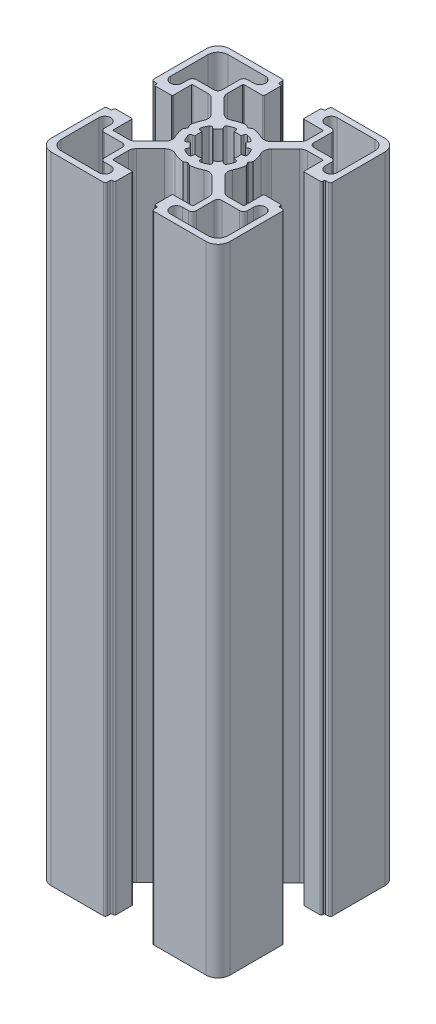
from build123d import *

# Parameters (mm, degrees)
BOSS_EXTRUDE1_DEPTH = 160


with BuildPart() as part:
    # Sketch1 → Boss-Extrude1 (new body)
    with BuildSketch(Plane(origin=(0, 0, 0), x_dir=(1, 0, 0), z_dir=(0, 1, 0))):
        with BuildLine():
            Line((7.563483841, 5.858695924), (11.129779796, 9.424987881))
            ThreePointArc((11.129779796, 9.424987881), (11.76062452, 9.846504465), (12.504756421, 9.994521395))
            Line((12.504756421, 9.994521395), (16.316902359, 9.994521395))
            ThreePointArc((16.316902359, 9.994521395), (16.458323963, 9.935942648), (16.51690271, 9.794521044))
            Line((16.51690271, 9.794521044), (16.51690271, 5.20001408))
            ThreePointArc((16.51690271, 5.20001408), (16.575481456, 5.058592476), (16.716903061, 5.000013729))
            Line((16.716903061, 5.000013729), (20.719599813, 5.000013729))
            ThreePointArc((20.719599813, 5.000013729), (20.931731335, 5.087881483), (21.019599089, 5.300013005))
            Line((21.019599089, 5.300013005), (21.019599089, 5.500003954))
            ThreePointArc((21.019599089, 5.500003954), (21.107466988, 5.71213583), (21.319598864, 5.800003729))
            Line((21.319598864, 5.800003729), (21.999979422, 5.800003729))
            ThreePointArc((21.999979422, 5.800003729), (22.353532548, 5.946450229), (22.499979048, 6.300003356))
            Line((22.499979048, 6.300003356), (22.499979048, 19.500015971))
            ThreePointArc((22.499979048, 19.500015971), (21.621300048, 21.62133473), (19.499981289, 22.50001373))
            Line((19.499981289, 22.50001373), (6.37570892, 22.50001373))
            ThreePointArc((6.37570892, 22.50001373), (6.022155794, 22.35356723), (5.875709294, 22.000014103))
            Line((5.875709294, 22.000014103), (5.875709294, 21.300013005))
            ThreePointArc((5.875709294, 21.300013005), (5.78784154, 21.087881482), (5.575710018, 21.000013729))
            Line((5.575710018, 21.000013729), (5.299998684, 21.000013729))
            ThreePointArc((5.299998684, 21.000013729), (5.087867516, 20.912146122), (4.999999909, 20.700014953))
            Line((4.999999909, 20.700014953), (4.999999909, 16.666812288))
            ThreePointArc((4.999999909, 16.666812288), (5.058578802, 16.52539033), (5.20000076, 16.466811437))
            Line((5.20000076, 16.466811437), (9.905385127, 16.466811437))
            ThreePointArc((9.905385127, 16.466811437), (10.046806731, 16.408232691), (10.105385478, 16.266811086))
            Line((10.105385478, 16.266811086), (10.105385478, 12.471582811))
            ThreePointArc((10.105385478, 12.471582811), (9.953144497, 11.706215717), (9.519598864, 11.057368824))
            Line((9.519598864, 11.057368824), (5.944897897, 7.482667857))
            ThreePointArc((5.944897897, 7.482667857), (4.854602604, 6.96783564), (3.666501718, 7.17329201))
            ThreePointArc((3.666501718, 7.17329201), (2.308631207, 7.714000899), (0.875344921, 8.000128222))
            ThreePointArc((0.875344921, 8.000128222), (0.813048151, 7.996979672), (0.754751151, 7.974792726))
            Line((0.754751151, 7.974792726), (0.112630526, 7.606936313))
            ThreePointArc((0.112630526, 7.606936313), (0.062965968, 7.559088119), (2.065e-06, 7.530953356))
            ThreePointArc((2.065e-06, 7.530953356), (-0.062961837, 7.559088119), (-0.112626394, 7.606936313))
            Line((-0.112626394, 7.606936313), (-0.754745572, 7.974791896))
            ThreePointArc((-0.754745572, 7.974791896), (-0.813042564, 7.99697884), (-0.875339325, 8.000127394))
            ThreePointArc((-0.875339325, 8.000127394), (-2.308625867, 7.714000103), (-3.666496612, 7.173291142))
            ThreePointArc((-3.666496612, 7.173291142), (-4.854599203, 6.967834938), (-5.944895348, 7.482669215))
            Line((-5.944895348, 7.482669215), (-9.519596331, 11.057370197))
            ThreePointArc((-9.519596331, 11.057370197), (-9.953141964, 11.70621709), (-10.105382945, 12.471584185))
            Line((-10.105382945, 12.471584185), (-10.105382945, 16.266811086))
            ThreePointArc((-10.105382945, 16.266811086), (-10.046804198, 16.408232691), (-9.905382594, 16.466811437))
            Line((-9.905382594, 16.466811437), (-5.200000942, 16.466811437))
            ThreePointArc((-5.200000942, 16.466811437), (-5.058578984, 16.52539033), (-5.000000091, 16.666812288))
            Line((-5.000000091, 16.666812288), (-5.000000091, 20.700014953))
            ThreePointArc((-5.000000091, 20.700014953), (-5.087867699, 20.912146122), (-5.299998867, 21.000013729))
            Line((-5.299998867, 21.000013729), (-5.575710202, 21.000013729))
            ThreePointArc((-5.575710202, 21.000013729), (-5.787841724, 21.087881482), (-5.875709478, 21.300013005))
            Line((-5.875709478, 21.300013005), (-5.875709478, 22.000014104))
            ThreePointArc((-5.875709478, 22.000014104), (-6.022155978, 22.35356723), (-6.375709104, 22.50001373))
            Line((-6.375709104, 22.50001373), (-19.499981473, 22.50001373))
            ThreePointArc((-19.499981473, 22.50001373), (-21.621300232, 21.62133473), (-22.499979232, 19.500015971))
            Line((-22.499979232, 19.500015971), (-22.499979232, 6.300003356))
            ThreePointArc((-22.499979232, 6.300003356), (-22.353532732, 5.946450229), (-21.999979605, 5.800003729))
            Line((-21.999979605, 5.800003729), (-21.319599047, 5.800003729))
            ThreePointArc((-21.319599047, 5.800003729), (-21.107467171, 5.71213583), (-21.019599271, 5.500003954))
            Line((-21.019599271, 5.500003954), (-21.019599271, 5.300013005))
            ThreePointArc((-21.019599271, 5.300013005), (-20.931731518, 5.087881483), (-20.719599995, 5.000013729))
            Line((-20.719599995, 5.000013729), (-16.716903244, 5.000013729))
            ThreePointArc((-16.716903244, 5.000013729), (-16.57548164, 5.058592476), (-16.516902894, 5.20001408))
            Line((-16.516902894, 5.20001408), (-16.516902894, 9.794521044))
            ThreePointArc((-16.516902894, 9.794521044), (-16.458324147, 9.935942648), (-16.316902543, 9.994521395))
            Line((-16.316902543, 9.994521395), (-12.504755574, 9.994521395))
            ThreePointArc((-12.504755574, 9.994521395), (-11.760623673, 9.846504465), (-11.129778949, 9.424987881))
            Line((-11.129778949, 9.424987881), (-7.563484024, 5.858696956))
            ThreePointArc((-7.563484024, 5.858696956), (-7.018857309, 4.793955357), (-7.200363541, 3.611860429))
            ThreePointArc((-7.200363541, 3.611860429), (-7.719534914, 2.299057702), (-7.999860794, 0.915436613))
            ThreePointArc((-7.999860794, 0.915436613), (-7.996805132, 0.851929863), (-7.97397167, 0.792591196))
            Line((-7.97397167, 0.792591196), (-7.540055962, 0.046829926))
            ThreePointArc((-7.540055962, 0.046829926), (-7.534291471, 0.023676009), (-7.531325428, 3.7e-07))
            ThreePointArc((-7.531325428, 3.7e-07), (-7.534291471, -0.023675268), (-7.540055962, -0.046829185))
            Line((-7.540055962, -0.046829185), (-7.97397167, -0.792590455))
            ThreePointArc((-7.97397167, -0.792590455), (-7.996805132, -0.851929122), (-7.999860794, -0.915435872))
            ThreePointArc((-7.999860794, -0.915435872), (-7.719534914, -2.299056961), (-7.200363541, -3.611859688))
            ThreePointArc((-7.200363541, -3.611859688), (-7.018857309, -4.793954616), (-7.563484024, -5.858696215))
            Line((-7.563484024, -5.858696215), (-11.12977998, -9.424988171))
            ThreePointArc((-11.12977998, -9.424988171), (-11.760624704, -9.846504756), (-12.504756605, -9.994521685))
            Line((-12.504756605, -9.994521685), (-16.316902543, -9.994521685))
            ThreePointArc((-16.316902543, -9.994521685), (-16.458324147, -9.935942938), (-16.516902894, -9.794521334))
            Line((-16.516902894, -9.794521334), (-16.516902894, -5.200014371))
            ThreePointArc((-16.516902894, -5.200014371), (-16.57548164, -5.058592767), (-16.716903244, -5.000014021))
            Line((-16.716903244, -5.000014021), (-20.719599995, -5.000014021))
            ThreePointArc((-20.719599995, -5.000014021), (-20.931731518, -5.087881774), (-21.019599271, -5.300013296))
            Line((-21.019599271, -5.300013296), (-21.019599271, -5.500004245))
            ThreePointArc((-21.019599271, -5.500004245), (-21.107467171, -5.71213612), (-21.319599047, -5.80000402))
            Line((-21.319599047, -5.80000402), (-21.999979605, -5.80000402))
            ThreePointArc((-21.999979605, -5.80000402), (-22.353532732, -5.94645052), (-22.499979232, -6.300003647))
            Line((-22.499979232, -6.300003647), (-22.499979232, -19.500016261))
            ThreePointArc((-22.499979232, -19.500016261), (-21.621300232, -21.62133502), (-19.499981473, -22.50001402))
            Line((-19.499981473, -22.50001402), (-6.375709104, -22.50001402))
            ThreePointArc((-6.375709104, -22.50001402), (-6.022155978, -22.35356752), (-5.875709478, -22.000014394))
            Line((-5.875709478, -22.000014394), (-5.875709478, -21.300013295))
            ThreePointArc((-5.875709478, -21.300013295), (-5.787841724, -21.087881773), (-5.575710202, -21.000014019))
            Line((-5.575710202, -21.000014019), (-5.299998867, -21.000014019))
            ThreePointArc((-5.299998867, -21.000014019), (-5.087867699, -20.912146412), (-5.000000091, -20.700015244))
            Line((-5.000000091, -20.700015244), (-5.000000091, -16.666812578))
            ThreePointArc((-5.000000091, -16.666812578), (-5.058578984, -16.52539062), (-5.200000942, -16.466811727))
            Line((-5.200000942, -16.466811727), (-9.905382594, -16.466811727))
            ThreePointArc((-9.905382594, -16.466811727), (-10.046804198, -16.40823298), (-10.105382945, -16.266811376))
            Line((-10.105382945, -16.266811376), (-10.105382945, -12.471581681))
            ThreePointArc((-10.105382945, -12.471581681), (-9.953141964, -11.706214586), (-9.519596331, -11.057367693))
            Line((-9.519596331, -11.057367693), (-5.944895364, -7.482666726))
            ThreePointArc((-5.944895364, -7.482666726), (-4.854601518, -6.967832762), (-3.66650075, -7.173286521))
            ThreePointArc((-3.66650075, -7.173286521), (-2.30862839, -7.713996836), (-0.875339942, -8.000124808))
            ThreePointArc((-0.875339942, -8.000124808), (-0.81304361, -7.99697628), (-0.754747019, -7.97478949))
            Line((-0.754747019, -7.97478949), (-0.112626395, -7.606933078))
            ThreePointArc((-0.112626395, -7.606933078), (-0.062961838, -7.559084884), (2.065e-06, -7.530950121))
            ThreePointArc((2.065e-06, -7.530950121), (0.062965968, -7.559084884), (0.112630526, -7.606933078))
            Line((0.112630526, -7.606933078), (0.754751151, -7.974789491))
            ThreePointArc((0.754751151, -7.974789491), (0.813048151, -7.996976437), (0.875344921, -8.000124987))
            ThreePointArc((0.875344921, -8.000124987), (2.308629801, -7.71399808), (3.666499103, -7.173290103))
            ThreePointArc((3.666499103, -7.173290103), (4.854601719, -6.967833865), (5.944897897, -7.482668146))
            Line((5.944897897, -7.482668146), (9.519598864, -11.057369113))
            ThreePointArc((9.519598864, -11.057369113), (9.953144497, -11.706216006), (10.105385478, -12.471583101))
            Line((10.105385478, -12.471583101), (10.105385478, -16.266811376))
            ThreePointArc((10.105385478, -16.266811376), (10.046806731, -16.40823298), (9.905385127, -16.466811727))
            Line((9.905385127, -16.466811727), (5.20000076, -16.466811727))
            ThreePointArc((5.20000076, -16.466811727), (5.058578802, -16.52539062), (4.999999909, -16.666812578))
            Line((4.999999909, -16.666812578), (4.999999909, -20.700015244))
            ThreePointArc((4.999999909, -20.700015244), (5.087867516, -20.912146412), (5.299998684, -21.000014019))
            Line((5.299998684, -21.000014019), (5.575710018, -21.000014019))
            ThreePointArc((5.575710018, -21.000014019), (5.78784154, -21.087881773), (5.875709294, -21.300013295))
            Line((5.875709294, -21.300013295), (5.875709294, -22.000014394))
            ThreePointArc((5.875709294, -22.000014394), (6.022155794, -22.35356752), (6.37570892, -22.50001402))
            Line((6.37570892, -22.50001402), (19.499981289, -22.50001402))
            ThreePointArc((19.499981289, -22.50001402), (21.621300048, -21.62133502), (22.499979048, -19.500016261))
            Line((22.499979048, -19.500016261), (22.499979048, -6.300003646))
            ThreePointArc((22.499979048, -6.300003646), (22.353532548, -5.94645052), (21.999979422, -5.80000402))
            Line((21.999979422, -5.80000402), (21.319598864, -5.80000402))
            ThreePointArc((21.319598864, -5.80000402), (21.107466988, -5.71213612), (21.019599089, -5.500004245))
            Line((21.019599089, -5.500004245), (21.019599089, -5.300013297))
            ThreePointArc((21.019599089, -5.300013297), (20.931731335, -5.087881774), (20.719599813, -5.000014021))
            Line((20.719599813, -5.000014021), (16.716903061, -5.000014021))
            ThreePointArc((16.716903061, -5.000014021), (16.575481456, -5.058592767), (16.51690271, -5.200014371))
            Line((16.51690271, -5.200014371), (16.51690271, -9.794521334))
            ThreePointArc((16.51690271, -9.794521334), (16.458323963, -9.935942938), (16.316902359, -9.994521685))
            Line((16.316902359, -9.994521685), (12.504756421, -9.994521685))
            ThreePointArc((12.504756421, -9.994521685), (11.76062452, -9.846504756), (11.129779797, -9.424988171))
            Line((11.129779797, -9.424988171), (7.56348384, -5.858696215))
            ThreePointArc((7.56348384, -5.858696215), (7.018857125, -4.793954616), (7.200363357, -3.611859689))
            ThreePointArc((7.200363357, -3.611859689), (7.71953473, -2.299056961), (7.99986061, -0.915435872))
            ThreePointArc((7.99986061, -0.915435872), (7.996804948, -0.851929122), (7.973971486, -0.792590456))
            Line((7.973971486, -0.792590456), (7.54005578, -0.046829188))
            ThreePointArc((7.54005578, -0.046829188), (7.53429135, -0.023675779), (7.531325245, -6.6e-07))
            ThreePointArc((7.531325245, -6.6e-07), (7.534291289, 0.023674979), (7.54005578, 0.046828898))
            Line((7.54005578, 0.046828898), (7.973971486, 0.792590166))
            ThreePointArc((7.973971486, 0.792590166), (7.996804949, 0.851928832), (7.99986061, 0.915435582))
            ThreePointArc((7.99986061, 0.915435582), (7.719534731, 2.299056671), (7.200363358, 3.611859399))
            ThreePointArc((7.200363358, 3.611859399), (7.018857126, 4.793954326), (7.563483841, 5.858695924))
        make_face()
        with BuildLine():
            Line((-17.99997923, 9.000204729), (-17.99997923, 10.550013476))
            ThreePointArc((-17.99997923, 10.550013476), (-17.70708623, 11.257119729), (-16.999979977, 11.550012729))
            Line((-16.999979977, 11.550012729), (-12.549977483, 11.550012729))
            ThreePointArc((-12.549977483, 11.550012729), (-11.84287123, 11.842905729), (-11.54997823, 12.550011982))
            Line((-11.54997823, 12.550011982), (-11.54997823, 17.000014476))
            ThreePointArc((-11.54997823, 17.000014476), (-11.25708523, 17.707120729), (-10.549978977, 18.000013729))
            Line((-10.549978977, 18.000013729), (-8.99997923, 18.000013729))
            ThreePointArc((-8.99997923, 18.000013729), (-7.49997923, 19.500013729), (-8.99997923, 21.000013729))
            Line((-8.99997923, 21.000013729), (-18.499981098, 21.000013729))
            ThreePointArc((-18.499981098, 21.000013729), (-20.26774673, 20.267781229), (-20.99997923, 18.500015597))
            Line((-20.99997923, 18.500015597), (-20.99997923, 9.000204729))
            ThreePointArc((-20.99997923, 9.000204729), (-19.49997923, 7.500204729), (-17.99997923, 9.000204729))
        make_face(mode=Mode.SUBTRACT)
        with BuildLine():
            Line((0.967518273, 5.481094418), (0.867385333, 4.924170439))
            ThreePointArc((0.867385333, 4.924170439), (-3.404e-06, 4.999981493), (-0.867392141, 4.924170439))
            Line((-0.867392141, 4.924170439), (-0.967525085, 5.48109443))
            ThreePointArc((-0.967525085, 5.48109443), (-1.18787304, 5.829596016), (-1.595121059, 5.894060173))
            ThreePointArc((-1.595121059, 5.894060173), (-2.337474987, 5.644060679), (-3.0416713, 5.300991221))
            ThreePointArc((-3.0416713, 5.300991221), (-3.284300912, 4.965857552), (-3.191387249, 4.562681715))
            Line((-3.191387249, 4.562681715), (-2.864003826, 4.098457013))
            ThreePointArc((-2.864003826, 4.098457013), (-3.530136355, 3.540908116), (-4.089716295, 2.876480837))
            Line((-4.089716295, 2.876480837), (-4.566781049, 3.208143991))
            ThreePointArc((-4.566781049, 3.208143991), (-4.968981864, 3.298752353), (-5.302521511, 3.056416481))
            ThreePointArc((-5.302521511, 3.056416481), (-5.650679971, 2.354692469), (-5.906040083, 1.614137194))
            ThreePointArc((-5.906040083, 1.614137194), (-5.840630787, 1.205603075), (-5.48985103, 0.986212864))
            Line((-5.48985103, 0.986212864), (-4.920549171, 0.887804317))
            ThreePointArc((-4.920549171, 0.887804317), (-5.000003405, -1.8509e-05), (-4.92054917, -0.887841334))
            Line((-4.92054917, -0.887841334), (-5.48973413, -0.986229672))
            ThreePointArc((-5.48973413, -0.986229672), (-5.84059179, -1.205595835), (-5.906027737, -1.614179668))
            ThreePointArc((-5.906027737, -1.614179668), (-5.650660878, -2.354735576), (-5.302495324, -3.056459191))
            ThreePointArc((-5.302495324, -3.056459191), (-4.968965627, -3.298777294), (-4.566781049, -3.208181006))
            Line((-4.566781049, -3.208181006), (-4.089716295, -2.876517852))
            ThreePointArc((-4.089716295, -2.876517852), (-3.530136355, -3.540945131), (-2.864003826, -4.098494028))
            Line((-2.864003826, -4.098494028), (-3.191315305, -4.562616715))
            ThreePointArc((-3.191315305, -4.562616715), (-3.284288314, -4.9658247), (-3.041645074, -5.301003633))
            ThreePointArc((-3.041645074, -5.301003633), (-2.337436005, -5.644074141), (-1.595068803, -5.894071587))
            ThreePointArc((-1.595068803, -5.894071587), (-1.187863583, -5.829591875), (-0.967525085, -5.481131446))
            Line((-0.967525085, -5.481131446), (-0.867392142, -4.924207454))
            ThreePointArc((-0.867392142, -4.924207454), (-3.405e-06, -5.000018508), (0.867385333, -4.924207454))
            Line((0.867385333, -4.924207454), (0.967518273, -5.481131433))
            ThreePointArc((0.967518273, -5.481131433), (1.187884068, -5.829612183), (1.595127065, -5.894056407))
            ThreePointArc((1.595127065, -5.894056407), (2.337463214, -5.64406402), (3.04164388, -5.301006091))
            ThreePointArc((3.04164388, -5.301006091), (3.284272431, -4.965888777), (3.191382531, -4.562721697))
            Line((3.191382531, -4.562721697), (2.863997017, -4.098494027))
            ThreePointArc((2.863997017, -4.098494027), (3.530129546, -3.540945131), (4.089709486, -2.876517851))
            Line((4.089709486, -2.876517851), (4.56677425, -3.208181013))
            ThreePointArc((4.56677425, -3.208181013), (4.968991235, -3.298778206), (5.302526078, -3.056413061))
            ThreePointArc((5.302526078, -3.056413061), (5.650679647, -2.354700627), (5.90603791, -1.614157983))
            ThreePointArc((5.90603791, -1.614157983), (5.840629826, -1.205623017), (5.489849863, -0.98623192))
            Line((5.489849863, -0.98623192), (4.920545674, -0.88782297))
            ThreePointArc((4.920545674, -0.88782297), (4.999996595, -1.94e-07), (4.92053917, 0.887822))
            Line((4.92053917, 0.887822), (5.489724104, 0.986210336))
            ThreePointArc((5.489724104, 0.986210336), (5.840595493, 1.20557008), (5.90603791, 1.614161218))
            ThreePointArc((5.90603791, 1.614161218), (5.650669489, 2.354728137), (5.302499707, 3.056461843))
            ThreePointArc((5.302499707, 3.056461843), (4.968955649, 3.298763634), (4.56677425, 3.208143998))
            Line((4.56677425, 3.208143998), (4.089709486, 2.876480836))
            ThreePointArc((4.089709486, 2.876480836), (3.530129546, 3.540908115), (2.863997017, 4.098457012))
            Line((2.863997017, 4.098457012), (3.191308496, 4.562579701))
            ThreePointArc((3.191308496, 4.562579701), (3.284310107, 4.965799272), (3.041663899, 5.300997928))
            ThreePointArc((3.041663899, 5.300997928), (2.337448292, 5.644073372), (1.595073641, 5.894073887))
            ThreePointArc((1.595073641, 5.894073887), (1.18784779, 5.829586125), (0.967518273, 5.481094418))
        make_face(mode=Mode.SUBTRACT)
        with BuildLine():
            Line((-20.99997923, -9.000205019), (-20.99997923, -18.500015887))
            ThreePointArc((-20.99997923, -18.500015887), (-20.26774673, -20.267781519), (-18.499981098, -21.000014019))
            Line((-18.499981098, -21.000014019), (-8.99997923, -21.000014019))
            ThreePointArc((-8.99997923, -21.000014019), (-7.49997923, -19.500014019), (-8.99997923, -18.000014019))
            Line((-8.99997923, -18.000014019), (-10.549978977, -18.000014019))
            ThreePointArc((-10.549978977, -18.000014019), (-11.25708523, -17.707121019), (-11.54997823, -17.000014766))
            Line((-11.54997823, -17.000014766), (-11.54997823, -12.550012272))
            ThreePointArc((-11.54997823, -12.550012272), (-11.84287123, -11.842906019), (-12.549977483, -11.550013019))
            Line((-12.549977483, -11.550013019), (-16.999979977, -11.550013019))
            ThreePointArc((-16.999979977, -11.550013019), (-17.70708623, -11.257120019), (-17.99997923, -10.550013766))
            Line((-17.99997923, -10.550013766), (-17.99997923, -9.000205019))
            ThreePointArc((-17.99997923, -9.000205019), (-19.49997923, -7.500205019), (-20.99997923, -9.000205019))
        make_face(mode=Mode.SUBTRACT)
        with BuildLine():
            Line((20.999979046, 9.000204729), (20.999979046, 18.500015597))
            ThreePointArc((20.999979046, 18.500015597), (20.267746546, 20.267781229), (18.499980914, 21.000013729))
            Line((18.499980914, 21.000013729), (8.999979046, 21.000013729))
            ThreePointArc((8.999979046, 21.000013729), (7.499979046, 19.500013729), (8.999979046, 18.000013729))
            Line((8.999979046, 18.000013729), (10.549978793, 18.000013729))
            ThreePointArc((10.549978793, 18.000013729), (11.257085046, 17.707120729), (11.549978046, 17.000014476))
            Line((11.549978046, 17.000014476), (11.549978046, 12.550011982))
            ThreePointArc((11.549978046, 12.550011982), (11.842871046, 11.842905729), (12.549977299, 11.550012729))
            Line((12.549977299, 11.550012729), (16.999979793, 11.550012729))
            ThreePointArc((16.999979793, 11.550012729), (17.707086046, 11.257119729), (17.999979046, 10.550013476))
            Line((17.999979046, 10.550013476), (17.999979046, 9.000204729))
            ThreePointArc((17.999979046, 9.000204729), (19.499979046, 7.500204729), (20.999979046, 9.000204729))
        make_face(mode=Mode.SUBTRACT)
        with BuildLine():
            Line((16.999979793, -11.550013019), (12.549977299, -11.550013019))
            ThreePointArc((12.549977299, -11.550013019), (11.842871046, -11.842906019), (11.549978046, -12.550012272))
            Line((11.549978046, -12.550012272), (11.549978046, -17.000014766))
            ThreePointArc((11.549978046, -17.000014766), (11.257085046, -17.707121019), (10.549978793, -18.000014019))
            Line((10.549978793, -18.000014019), (8.999979046, -18.000014019))
            ThreePointArc((8.999979046, -18.000014019), (7.499979046, -19.500014019), (8.999979046, -21.000014019))
            Line((8.999979046, -21.000014019), (18.499980914, -21.000014019))
            ThreePointArc((18.499980914, -21.000014019), (20.267746546, -20.267781519), (20.999979046, -18.500015887))
            Line((20.999979046, -18.500015887), (20.999979046, -9.000205019))
            ThreePointArc((20.999979046, -9.000205019), (19.499979046, -7.500205019), (17.999979046, -9.000205019))
            Line((17.999979046, -9.000205019), (17.999979046, -10.550013766))
            ThreePointArc((17.999979046, -10.550013766), (17.707086046, -11.257120019), (16.999979793, -11.550013019))
        make_face(mode=Mode.SUBTRACT)
    extrude(amount=BOSS_EXTRUDE1_DEPTH)


solid = part.part
